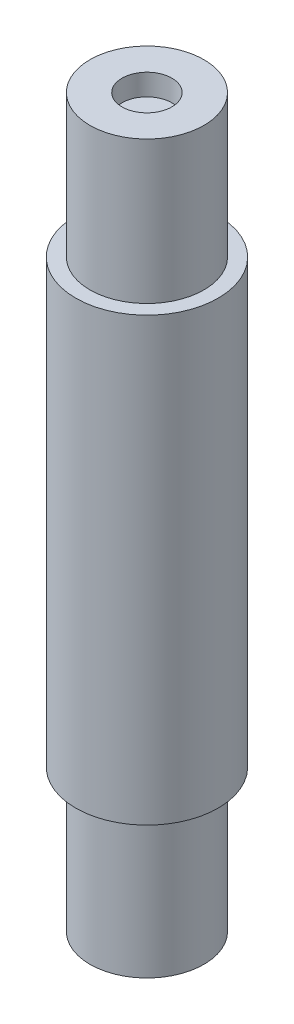
from build123d import *

# Parameters (mm, degrees)
SKETCH1_R                = 5
BOSS_EXTRUDE1_DEPTH      = 31
BOSS_EXTRUDE2_DEPTH      = 10
BOSS_EXTRUDE2_DEPTH_BACK = 41
SKETCH2_R                = 4
SKETCH3_R                = 1.75
CUT_EXTRUDE1_DEPTH       = 1.5
CUT_EXTRUDE2_START       = -1.5
SKETCH4_R                = 1.75
CUT_EXTRUDE2_DEPTH       = 1.5


with BuildPart() as part:
    # Sketch1 → Boss-Extrude1 (new body)
    with BuildSketch(Plane(origin=(0, 0, 0), x_dir=(1, 0, 0), z_dir=(0, 1, 0))):
        with Locations(Location((0, 0, 0), (0, 0, 270))):
            Circle(SKETCH1_R)
    extrude(amount=BOSS_EXTRUDE1_DEPTH)

    # Sketch2 → Boss-Extrude2 (add, two sides: drawn at the far end of the back side and taken through both)
    with BuildSketch(Plane(origin=(0, 31, 0), x_dir=(1, 0, 0), z_dir=(0, 1, 0)).offset(-BOSS_EXTRUDE2_DEPTH_BACK)):
        with Locations(Location((0, 0, 0), (0, 0, 270))):
            Circle(SKETCH2_R)
    extrude(amount=BOSS_EXTRUDE2_DEPTH + BOSS_EXTRUDE2_DEPTH_BACK)

    # Sketch3 → Cut-Extrude1 (cut)
    with BuildSketch(Plane.XZ.offset(10)):
        with Locations(Location((0, 0, 0), (0, 0, 270))):
            Circle(SKETCH3_R)
    extrude(amount=-CUT_EXTRUDE1_DEPTH, mode=Mode.SUBTRACT)

    # Sketch4 → Cut-Extrude2 (cut)
    with BuildSketch(Plane(origin=(0, 41, 0), x_dir=(1, 0, 0), z_dir=(0, 1, 0)).offset(CUT_EXTRUDE2_START)):
        with Locations(Location((0, 0, 0), (0, 0, 90))):
            Circle(SKETCH4_R)
    extrude(amount=CUT_EXTRUDE2_DEPTH, mode=Mode.SUBTRACT)


solid = part.part
